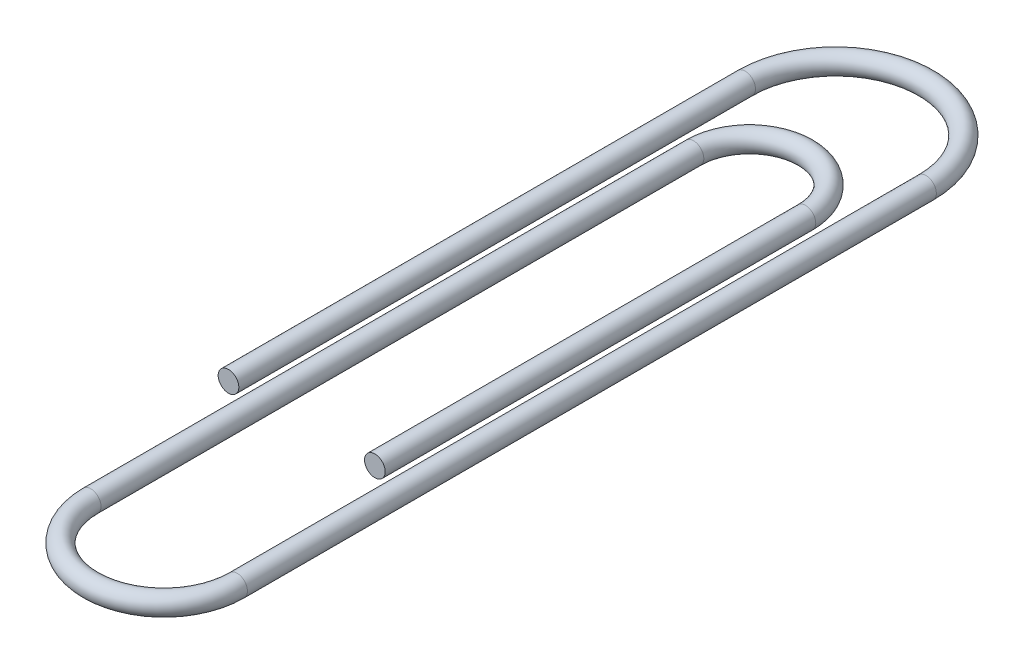
from build123d import *

# Parameters (mm, degrees)
SWEEP1_PROFILE_R = 0.6


with BuildPart() as part:
    # Sweep1: sweep along a path in Sketch1
    with BuildLine(Plane(origin=(0, 0, 0), x_dir=(1, 0, 0), z_dir=(0, 1, 0))) as sweep1_path:
        Line((0, 0), (0, 25))
        ThreePointArc((0, 25), (-3.25, 28.25), (-6.5, 25))
        Line((-6.5, 25), (-6.5, -10))
        ThreePointArc((-6.5, -10), (-2.25, -14.25), (2, -10))
        Line((2, -10), (2, 30))
        ThreePointArc((2, 30), (-3.25, 35.25), (-8.5, 30))
        Line((-8.5, 30), (-8.5, 0))
    # Sweep1 profile (on start of the path) → Sweep1 (sweep)
    with BuildSketch(Plane(origin=(0, 0, 0), x_dir=(-1, 0, 0), z_dir=(0, 0, -1))):
        Circle(SWEEP1_PROFILE_R)
    sweep(path=sweep1_path.line)


solid = part.part
